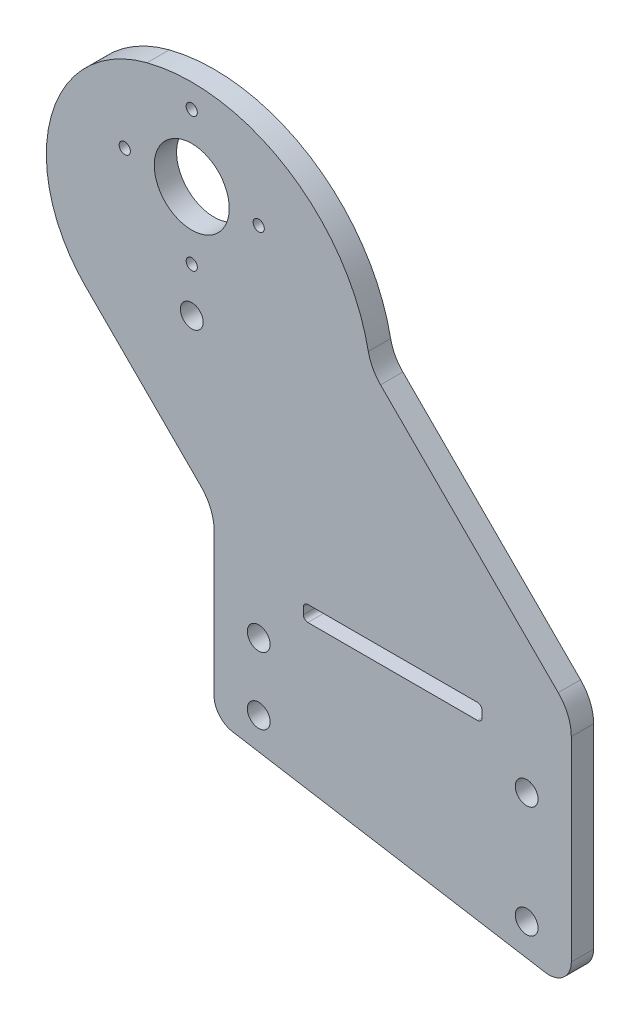
from build123d import *

# Parameters (mm, degrees)
SKETCH_1_R          = 2.55
SKETCH_1_R_2        = 8.4
EXTRUDE_1_DEPTH     = 5
FILLET_1_R          = 10
SKETCH_2_R          = 2.55
CUT_EXTRUDE_1_DEPTH = 112.121375081
FILLET_2_R          = 30
SKETCH_3_W          = 40
SKETCH_3_H          = 3
CUT_EXTRUDE_2_DEPTH = 112.121375081
SKETCH_5_W          = 40
SKETCH_5_H          = 0.5
CUT_EXTRUDE_4_DEPTH = 112.121375081
FILLET_3_R          = 1
CUT_EXTRUDE_5_DEPTH = 112.121375081
FILLET_4_R          = 5
SKETCH_7_R          = 1.25
CUT_EXTRUDE_6_DEPTH = 110.538877646


with BuildPart() as part:
    # ｽｹｯﾁ1 → ﾎﾞｽ - 押し出し1 (new body)
    with BuildSketch(Plane.XY):
        with BuildLine():
            Line((40, 33.6), (85, -11.4))
            Line((85, -11.4), (85, -71.4))
            Line((85, -71.4), (5, -71.4))
            Line((5, -71.4), (5, -11.4))
            Line((5, -11.4), (-40, 33.6))
            ThreePointArc((-40, 33.6), (0, 68.911288741), (40, 33.6))
        make_face()
        with Locations((75, -31.4)):
            Circle(SKETCH_1_R, mode=Mode.SUBTRACT)
        with Locations((75, -56.4)):
            Circle(SKETCH_1_R, mode=Mode.SUBTRACT)
        with Locations((0, 23.6)):
            Circle(SKETCH_1_R, mode=Mode.SUBTRACT)
        with Locations((0, 48.6)):
            Circle(SKETCH_1_R_2, mode=Mode.SUBTRACT)
    extrude(amount=EXTRUDE_1_DEPTH)

    # ﾌｨﾚｯﾄ1
    fillet_1_edges = [part.edges().sort_by_distance(p)[0] for p in [
        (40, 33.6, 2.5),
        (85, -11.4, 2.5),
        (5, -11.4, 2.5),
    ]]
    fillet(fillet_1_edges, radius=FILLET_1_R)

    # ｽｹｯﾁ2 → ｶｯﾄ - 押し出し1 (cut, through all)
    with BuildSketch(Plane.XY.offset(5)):
        with Locations((15, -46.4)):
            Circle(SKETCH_2_R)
        with Locations((15, -31.4)):
            Circle(SKETCH_2_R)
    extrude(amount=-CUT_EXTRUDE_1_DEPTH, mode=Mode.SUBTRACT)

    # ﾌｨﾚｯﾄ2
    fillet_2_edges = [part.edges().sort_by_distance(p)[0] for p in [
        (-40, 33.6, 2.5),
    ]]
    fillet(fillet_2_edges, radius=FILLET_2_R)

    # ｽｹｯﾁ3 → ｶｯﾄ - 押し出し2 (cut, through all)
    with BuildSketch(Plane(origin=(0, 0, 0), x_dir=(-1, 0, 0), z_dir=(0, 0, -1))):
        with Locations((-45, -21.4)):
            Rectangle(SKETCH_3_W, SKETCH_3_H)
    extrude(amount=-CUT_EXTRUDE_2_DEPTH, mode=Mode.SUBTRACT)

    # ｽｹｯﾁ5 → ｶｯﾄ - 押し出し4 (cut, through all)
    with BuildSketch(Plane(origin=(0, 0, 0), x_dir=(-1, 0, 0), z_dir=(0, 0, -1))):
        with Locations((-45, -19.65)):
            Rectangle(SKETCH_5_W, SKETCH_5_H)
    extrude(amount=-CUT_EXTRUDE_4_DEPTH, mode=Mode.SUBTRACT)

    # ﾌｨﾚｯﾄ3
    fillet_3_edges = [part.edges().sort_by_distance(p)[0] for p in [
        (25, -22.9, 2.5),
        (65, -22.9, 2.5),
        (65, -19.4, 2.5),
        (25, -19.4, 2.5),
    ]]
    fillet(fillet_3_edges, radius=FILLET_3_R)

    # ｽｹｯﾁ6 → ｶｯﾄ - 押し出し5 (cut, through all)
    with BuildSketch(Plane(origin=(0, 0, 0), x_dir=(-1, 0, 0), z_dir=(0, 0, -1))):
        Polygon((-5, -51.829889619), (-122.420662288, -71.4), (-5, -71.4), align=None)
    extrude(amount=-CUT_EXTRUDE_5_DEPTH, mode=Mode.SUBTRACT)

    # ﾌｨﾚｯﾄ4
    fillet_4_edges = [part.edges().sort_by_distance(p)[0] for p in [
        (85, -65.163222952, 2.5),
        (5, -51.829889619, 2.5),
    ]]
    fillet(fillet_4_edges, radius=FILLET_4_R)

    # ｽｹｯﾁ7 → ｶｯﾄ - 押し出し6 (cut, through all)
    with BuildSketch(Plane.XY.offset(5)):
        with Locations((0, 63.6)):
            Circle(SKETCH_7_R)
        with Locations((15, 48.6)):
            Circle(SKETCH_7_R)
        with Locations((0, 33.6)):
            Circle(SKETCH_7_R)
        with Locations((-15, 48.6)):
            Circle(SKETCH_7_R)
    extrude(amount=-CUT_EXTRUDE_6_DEPTH, mode=Mode.SUBTRACT)


solid = part.part
